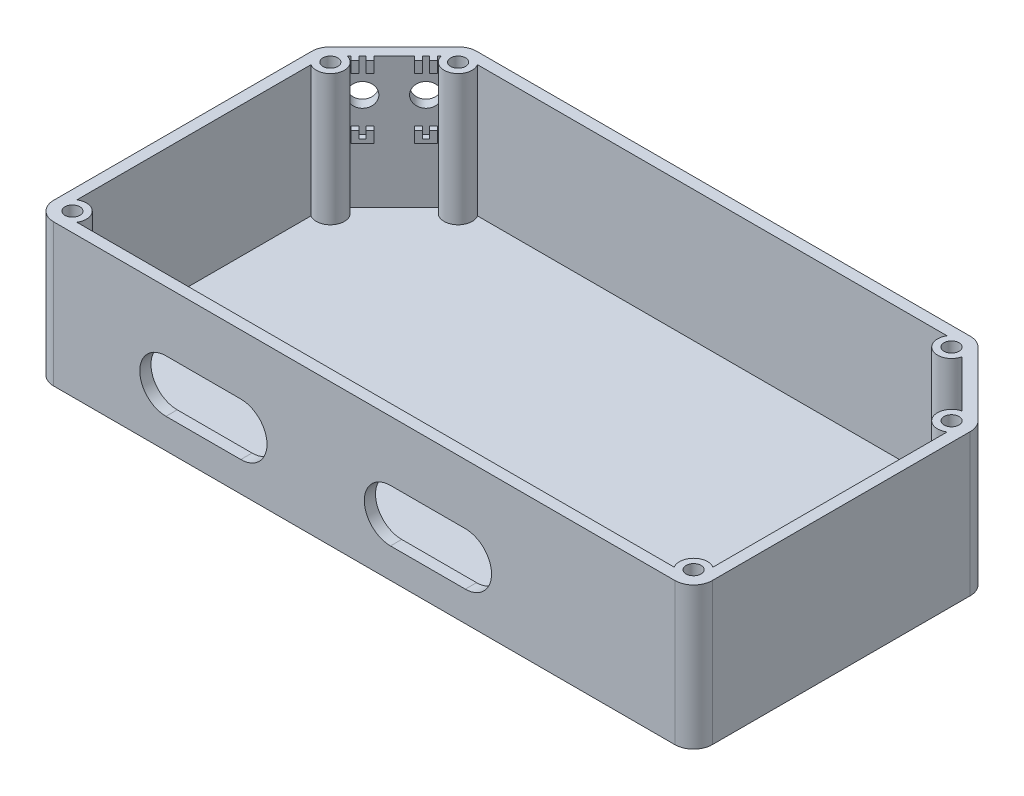
from build123d import *

# Parameters (mm, degrees)
BOSS_EXTRUDE1_DEPTH = 3
BOSS_EXTRUDE2_DEPTH = 35
SKETCH3_R           = 3.1
CUT_EXTRUDE1_DEPTH  = 10
SKETCH4_W           = 1.5
SKETCH4_H           = 3
BOSS_EXTRUDE3_DEPTH = 1.5
SKETCH6_R           = 3.75
BOSS_EXTRUDE4_DEPTH = 35
SKETCH7_R           = 2
CUT_EXTRUDE2_DEPTH  = 38
SKETCH8_R           = 2.6
CUT_EXTRUDE3_DEPTH  = 25
CUT_EXTRUDE4_DEPTH  = 3
FILLET1_R           = 5


with BuildPart() as part:
    # Sketch1 → Boss-Extrude1 (new body)
    with BuildSketch(Plane(origin=(0, 0, 0), x_dir=(1, 0, 0), z_dir=(0, 1, 0))):
        Polygon((-68, 48), (-88, 28), (-88, -48), (88, -48), (88, 28), (68, 48), align=None)
    extrude(amount=BOSS_EXTRUDE1_DEPTH)

    # Sketch2 → Boss-Extrude2 (add)
    with BuildSketch(Plane(origin=(0, 3, 0), x_dir=(1, 0, 0), z_dir=(0, 1, 0))):
        Polygon((88, 28), (68, 48), (-68, 48), (-88, 28), (-88, -48), (88, -48), align=None)
        Polygon((85, -45), (85, 26.757359313), (66.757359313, 45), (-66.757359313, 45), (-85, 26.757359313), (-85, -45), align=None, mode=Mode.SUBTRACT)
    extrude(amount=BOSS_EXTRUDE2_DEPTH)

    # Sketch3 → Cut-Extrude1 (cut)
    with BuildSketch(Plane(origin=(-58, 0, -58), x_dir=(-0.7071067811865475, 0, 0.7071067811865477), z_dir=(-0.7071067811865477, 0, -0.7071067811865475))):
        with Locations((34.284271247, 29)):
            Circle(SKETCH3_R)
        with Locations((22.284271247, 29)):
            Circle(SKETCH3_R)
    extrude(amount=-CUT_EXTRUDE1_DEPTH, mode=Mode.SUBTRACT)

    # Sketch4 → Boss-Extrude3 (add)
    with BuildSketch(Plane(origin=(-55.878679656, 0, -55.878679656), x_dir=(0.7071067811865476, 0, -0.7071067811865475), z_dir=(0.7071067811865475, 0, 0.7071067811865476))):
        with Locations((-20.834271247, 36.5)):
            Rectangle(SKETCH4_W, SKETCH4_H)
        Polygon((-22.284271247, 18.8), (-22.284271247, 19.8), (-22.984271247, 19.8), (-22.984271247, 21.8), (-24.484271247, 21.8), (-24.484271247, 18.8), align=None)
        Polygon((-21.584271247, 19.8), (-22.284271247, 19.8), (-22.284271247, 18.8), (-20.084271247, 18.8), (-20.084271247, 21.8), (-21.584271247, 21.8), align=None)
        Polygon((-32.084271247, 18.8), (-32.084271247, 21.8), (-33.584271247, 21.8), (-33.584271247, 19.8), (-34.984271247, 19.8), (-34.984271247, 21.8), (-36.484271247, 21.8), (-36.484271247, 18.8), align=None)
        with Locations((-35.734271247, 36.5)):
            Rectangle(SKETCH4_W, SKETCH4_H)
        with Locations((-23.734271247, 36.5)):
            Rectangle(SKETCH4_W, SKETCH4_H)
        with Locations((-32.834271247, 36.5)):
            Rectangle(SKETCH4_W, SKETCH4_H)
    extrude(amount=BOSS_EXTRUDE3_DEPTH)

    # Sketch6 → Boss-Extrude4 (add)
    with BuildSketch(Plane(origin=(0, 3, 0), x_dir=(1, 0, 0), z_dir=(0, 1, 0))):
        with Locations((-65.928932188, 43)):
            Circle(SKETCH6_R)
        with Locations((65.928932188, 43)):
            Circle(SKETCH6_R)
        with Locations((83, 25.928932188)):
            Circle(SKETCH6_R)
        with Locations((83, -43)):
            Circle(SKETCH6_R)
        with Locations((-83, -43)):
            Circle(SKETCH6_R)
        with Locations((-83, 25.928932188)):
            Circle(SKETCH6_R)
    extrude(amount=BOSS_EXTRUDE4_DEPTH)

    # Sketch7 → Cut-Extrude2 (cut)
    with BuildSketch(Plane(origin=(0, 38, 0), x_dir=(1, 0, 0), z_dir=(0, 1, 0))):
        with Locations(Location((-65.928932188, 43, 0), (0, 0, 270))):
            Circle(SKETCH7_R)
        with Locations(Location((-83, 25.928932188, 0), (0, 0, 270))):
            Circle(SKETCH7_R)
        with Locations(Location((-83, -43, 0), (0, 0, 270))):
            Circle(SKETCH7_R)
        with Locations(Location((83, -43, 0), (0, 0, 270))):
            Circle(SKETCH7_R)
        with Locations(Location((83, 25.928932188, 0), (0, 0, 270))):
            Circle(SKETCH7_R)
        with Locations(Location((65.928932188, 43, 0), (0, 0, 270))):
            Circle(SKETCH7_R)
    extrude(amount=-CUT_EXTRUDE2_DEPTH, mode=Mode.SUBTRACT)

    # Sketch8 → Cut-Extrude3 (cut)
    with BuildSketch(Plane.XZ):
        with Locations(Location((-83, 43, 0), (0, 0, 270))):
            Circle(SKETCH8_R)
        with Locations(Location((83, 43, 0), (0, 0, 270))):
            Circle(SKETCH8_R)
        with Locations(Location((83, -25.928932188, 0), (0, 0, 270))):
            Circle(SKETCH8_R)
        with Locations(Location((65.928932188, -43, 0), (0, 0, 270))):
            Circle(SKETCH8_R)
        with Locations(Location((-65.928932188, -43, 0), (0, 0, 270))):
            Circle(SKETCH8_R)
        with Locations(Location((-83, -25.928932188, 0), (0, 0, 270))):
            Circle(SKETCH8_R)
    extrude(amount=-CUT_EXTRUDE3_DEPTH, mode=Mode.SUBTRACT)

    # Sketch9 → Cut-Extrude4 (cut)
    with BuildSketch(Plane.XY.offset(48)):
        with BuildLine():
            Line((-33, 8), (-53, 8))
            ThreePointArc((-53, 8), (-60, 15), (-53, 22))
            Line((-53, 22), (-33, 22))
            ThreePointArc((-33, 22), (-26, 15), (-33, 8))
        make_face()
        with BuildLine():
            Line((27, 8), (7, 8))
            ThreePointArc((7, 8), (0, 15), (7, 22))
            Line((7, 22), (27, 22))
            ThreePointArc((27, 22), (34, 15), (27, 8))
        make_face()
    extrude(amount=-CUT_EXTRUDE4_DEPTH, mode=Mode.SUBTRACT)

    # Fillet1
    fillet1_edges = [part.edges().sort_by_distance(p)[0] for p in [
        (88, 19, 48),
        (-88, 19, 48),
        (-88, 19, -28),
        (-68, 19, -48),
        (68, 19, -48),
        (88, 19, -28),
    ]]
    fillet(fillet1_edges, radius=FILLET1_R)


solid = part.part
